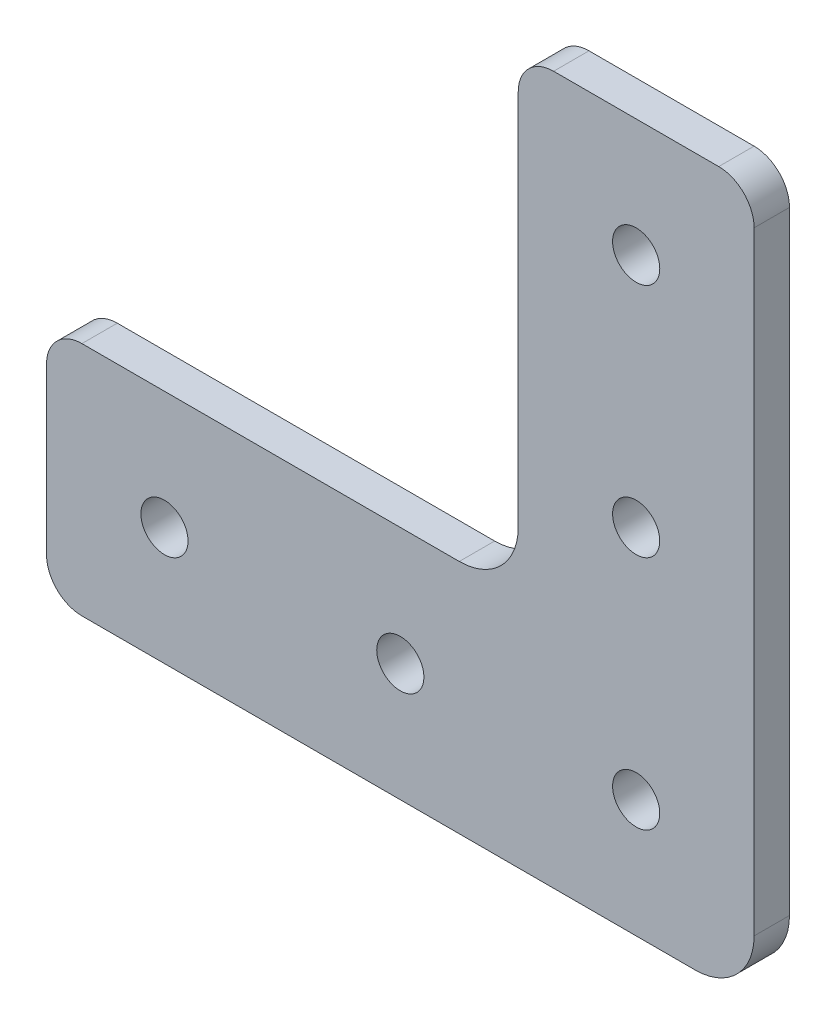
from build123d import *

# Parameters (mm, degrees)
SKETCH_1_W          = 20
SKETCH_1_H          = 60
EXTRUDE_1_DEPTH     = 3
SKETCH_2_W          = 60
SKETCH_2_H          = 20
EXTRUDE_2_DEPTH     = 3
SKETCH_3_R          = 2
CUT_EXTRUDE_1_DEPTH = 3
FILLET_3_R          = 5
FILLET_2_R          = 3


with BuildPart() as part:
    # 草图1 → 凸台-拉伸1 (new body)
    with BuildSketch(Plane.XY):
        with Locations((10, 30)):
            Rectangle(SKETCH_1_W, SKETCH_1_H)
    extrude(amount=EXTRUDE_1_DEPTH)

    # 草图2 → 凸台-拉伸2 (add)
    with BuildSketch(Plane.XY.offset(3)):
        with Locations((-10, 10)):
            Rectangle(SKETCH_2_W, SKETCH_2_H)
    extrude(amount=-EXTRUDE_2_DEPTH)

    # 草图3 → 切除-拉伸1 (cut)
    with BuildSketch(Plane.XY.offset(3)):
        with Locations((10, 10)):
            Circle(SKETCH_3_R)
        with Locations((10, 30)):
            Circle(SKETCH_3_R)
        with Locations((10, 50)):
            Circle(SKETCH_3_R)
        with Locations(Location((-10, 10, 0), (0, 0, 180))):
            Circle(SKETCH_3_R)
        with Locations(Location((-30, 10, 0), (0, 0, 180))):
            Circle(SKETCH_3_R)
    extrude(amount=-CUT_EXTRUDE_1_DEPTH, mode=Mode.SUBTRACT)

    # 圆角3
    fillet_3_edges = [part.edges().sort_by_distance(p)[0] for p in [
        (0, 20, 1.5),
        (20, 0, 1.5),
    ]]
    fillet(fillet_3_edges, radius=FILLET_3_R)

    # 圆角2
    fillet_2_edges = [part.edges().sort_by_distance(p)[0] for p in [
        (-40, 20, 1.5),
        (-40, 0, 1.5),
        (0, 60, 1.5),
        (20, 60, 1.5),
    ]]
    fillet(fillet_2_edges, radius=FILLET_2_R)


solid = part.part
